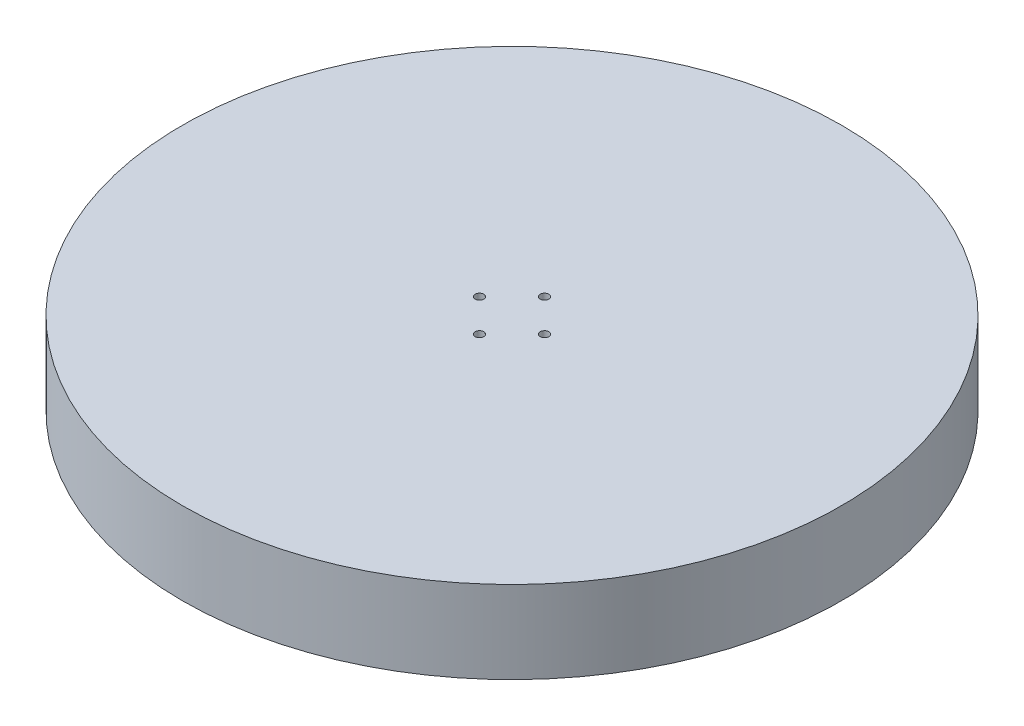
from build123d import *

# Parameters (mm, degrees)
SKETCH1_R           = 150
BOSS_EXTRUDE1_DEPTH = 4
SKETCH2_R           = 15
BOSS_EXTRUDE2_DEPTH = 30
SKETCH3_R           = 150
BOSS_EXTRUDE3_DEPTH = 4
SKETCH5_R           = 2
CUT_EXTRUDE1_DEPTH  = 53
SKETCH6_W           = 2
SKETCH6_H           = 38


with BuildPart() as part:
    # Sketch1 → Boss-Extrude1 (new body)
    with BuildSketch(Plane(origin=(0, 0, 0), x_dir=(1, 0, 0), z_dir=(0, 1, 0))):
        with Locations(Location((0, 0, 0), (0, 0, 270))):
            Circle(SKETCH1_R)
    extrude(amount=BOSS_EXTRUDE1_DEPTH)

    # Sketch2 → Boss-Extrude2 (add)
    with BuildSketch(Plane(origin=(0, 4, 0), x_dir=(1, 0, 0), z_dir=(0, 1, 0))):
        with Locations(Location((0, 85.738299576, 0), (0, 0, 270))):
            Circle(SKETCH2_R)
        with Locations(Location((85.738299576, 0, 0), (0, 0, 270))):
            Circle(SKETCH2_R)
        with Locations(Location((0, -85.738299576, 0), (0, 0, 270))):
            Circle(SKETCH2_R)
        with Locations(Location((-85.738299576, 0, 0), (0, 0, 270))):
            Circle(SKETCH2_R)
    extrude(amount=BOSS_EXTRUDE2_DEPTH)

    # Sketch3 → Boss-Extrude3 (add)
    with BuildSketch(Plane(origin=(0, 34, 0), x_dir=(1, 0, 0), z_dir=(0, 1, 0))):
        with Locations(Location((0, 0, 0), (0, 0, 270))):
            Circle(SKETCH3_R)
    extrude(amount=BOSS_EXTRUDE3_DEPTH)

    # Sketch5 → Cut-Extrude1 (cut)
    with BuildSketch(Plane.XZ):
        with Locations(Location((0, 15, 0), (0, 0, 90))):
            Circle(SKETCH5_R)
        with Locations(Location((15, 0, 0), (0, 0, 90))):
            Circle(SKETCH5_R)
        with Locations(Location((0, -15, 0), (0, 0, 90))):
            Circle(SKETCH5_R)
        with Locations(Location((-15, 0, 0), (0, 0, 90))):
            Circle(SKETCH5_R)
    extrude(amount=-CUT_EXTRUDE1_DEPTH, mode=Mode.SUBTRACT)

    # Sweep2: sweep along a curve in space
    with BuildLine() as sweep2_path:
        ThreePointArc((0, 38, 150), (106.066017178, 38, 106.066017178), (150, 38, 0))
        ThreePointArc((150, 38, 0), (106.066017178, 38, -106.066017178), (0, 38, -150))
        ThreePointArc((0, 38, -150), (-106.066017178, 38, -106.066017178), (-150, 38, 0))
        ThreePointArc((-150, 38, 0), (-106.066017178, 38, 106.066017178), (0, 38, 150))
    # Sketch6 → Sweep2 (sweep)
    with BuildSketch(Plane(origin=(0, 0, 0), x_dir=(0, 0, -1), z_dir=(1, 0, 0))):
        with Locations((-151, 19)):
            Rectangle(SKETCH6_W, SKETCH6_H)
    sweep(path=sweep2_path.line)


solid = part.part
